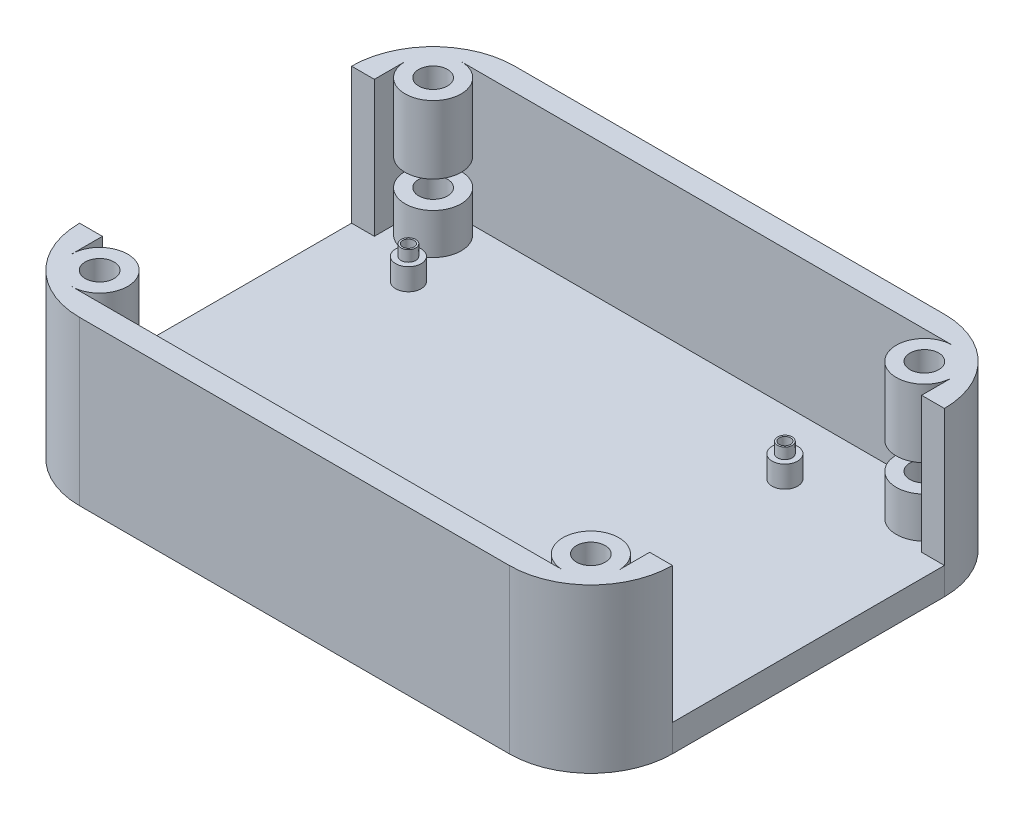
from build123d import *
from build123d.topology import SkipClean

# Parameters (mm, degrees)
BOSS_EXTRUDE1_DEPTH     = 5
SKETCH4_R               = 3.1
CUT_EXTRUDE1_DEPTH      = 4
BOSS_EXTRUDE3_DEPTH     = 30
CUT_EXTRUDE2_DEPTH      = 120.920807202
CUT_EXTRUDE2_DEPTH_BACK = 120.920807202
BOSS_EXTRUDE2_START     = 5
SKETCH3_R               = 1.35
SKETCH3_R_2             = 1.05
BOSS_EXTRUDE2_DEPTH     = 6
SKETCH13_R              = 2.35
SKETCH13_R_2            = 1.35
BOSS_EXTRUDE8_DEPTH     = 4
BOSS_EXTRUDE9_START     = -25
SKETCH14_R              = 5.15
SKETCH14_R_2            = 2.65
BOSS_EXTRUDE9_DEPTH     = 25
CUT_EXTRUDE4_START      = -25
SKETCH14_3_R            = 2.65
CUT_EXTRUDE4_DEPTH      = 25
CUT_EXTRUDE5_START      = -30
SKETCH14_4_R            = 2.65
CUT_EXTRUDE5_DEPTH      = 30
CUT_EXTRUDE6_DEPTH      = 2.5
CUT_EXTRUDE6_DEPTH_BACK = 2.5
CUT_EXTRUDE6_START      = -15
SKETCH14_6_R            = 5.15
SKETCH14_6_R_2          = 2.65


with BuildPart() as part:
    # Sketch1 → Boss-Extrude1 (new body)
    with BuildSketch(Plane(origin=(0, 0, 0), x_dir=(1, 0, 0), z_dir=(0, 1, 0))):
        with BuildLine():
            Line((-39.5, 40), (39.5, 40))
            ThreePointArc((39.5, 40), (50.106601718, 35.606601718), (54.5, 25))
            Line((54.5, 25), (54.5, -25))
            ThreePointArc((54.5, -25), (50.106601718, -35.606601718), (39.5, -40))
            Line((39.5, -40), (-39.5, -40))
            ThreePointArc((-39.5, -40), (-50.106601718, -35.606601718), (-54.5, -25))
            Line((-54.5, -25), (-54.5, 25))
            ThreePointArc((-54.5, 25), (-50.106601718, 35.606601718), (-39.5, 40))
        make_face()
    extrude(amount=BOSS_EXTRUDE1_DEPTH)

    # Sketch4 → Cut-Extrude1 (cut)
    with BuildSketch(Plane(origin=(0, 0, 0), x_dir=(1, 0, 0), z_dir=(0, 1, 0))):
        with Locations(Location((-37.5, -26.648136546, 0), (0, 0, 270))):
            Circle(SKETCH4_R)
        with Locations(Location((37.5, -26.648136546, 0), (0, 0, 270))):
            Circle(SKETCH4_R)
        with Locations(Location((37.5, 26.648136546, 0), (0, 0, 270))):
            Circle(SKETCH4_R)
        with Locations(Location((-37.5, 26.648136546, 0), (0, 0, 270))):
            Circle(SKETCH4_R)
        with Locations(Location((-17.5, 0, 0), (0, 0, 270))):
            Circle(SKETCH4_R)
        with Locations(Location((0, -17.5, 0), (0, 0, 270))):
            Circle(SKETCH4_R)
        with Locations(Location((17.5, 0, 0), (0, 0, 270))):
            Circle(SKETCH4_R)
        with Locations(Location((0, 17.5, 0), (0, 0, 270))):
            Circle(SKETCH4_R)
        with Locations(Location((-17.5, 17.5, 0), (0, 0, 270))):
            Circle(SKETCH4_R)
        with Locations(Location((17.5, 17.5, 0), (0, 0, 270))):
            Circle(SKETCH4_R)
        with Locations(Location((17.5, -17.5, 0), (0, 0, 270))):
            Circle(SKETCH4_R)
        with Locations(Location((-17.5, -17.5, 0), (0, 0, 270))):
            Circle(SKETCH4_R)
        with Locations(Location((0, 0, 0), (0, 0, 270))):
            Circle(SKETCH4_R)
    extrude(amount=CUT_EXTRUDE1_DEPTH, mode=Mode.SUBTRACT)

    # Sketch1<3> → Boss-Extrude3 (add)
    with BuildSketch(Plane(origin=(0, 0, 0), x_dir=(1, 0, 0), z_dir=(0, 1, 0))):
        with BuildLine():
            Line((-39.5, 40), (39.5, 40))
            ThreePointArc((39.5, 40), (50.106601718, 35.606601718), (54.5, 25))
            Line((54.5, 25), (54.5, -25))
            ThreePointArc((54.5, -25), (50.106601718, -35.606601718), (39.5, -40))
            Line((39.5, -40), (-39.5, -40))
            ThreePointArc((-39.5, -40), (-50.106601718, -35.606601718), (-54.5, -25))
            Line((-54.5, -25), (-54.5, 25))
            ThreePointArc((-54.5, 25), (-50.106601718, 35.606601718), (-39.5, 40))
        make_face()
        with BuildLine():
            ThreePointArc((-39.5, 33), (-45.156854249, 30.656854249), (-47.5, 25))
            Line((-47.5, 25), (-47.5, -25))
            ThreePointArc((-47.5, -25), (-45.156854249, -30.656854249), (-39.5, -33))
            Line((-39.5, -33), (39.5, -33))
            ThreePointArc((39.5, -33), (45.156854249, -30.656854249), (47.5, -25))
            Line((47.5, -25), (47.5, 25))
            ThreePointArc((47.5, 25), (45.156854249, 30.656854249), (39.5, 33))
            Line((39.5, 33), (-39.5, 33))
        make_face(mode=Mode.SUBTRACT)
    extrude(amount=BOSS_EXTRUDE3_DEPTH)

    # Sketch7 → Cut-Extrude2 (cut, two sides: drawn at the far end of the back side and taken through both)
    with BuildSketch(Plane.ZY.offset(54.5).offset(-CUT_EXTRUDE2_DEPTH_BACK)):
        Polygon((-20, 30), (-25, 30), (-25, 5), (-20, 5), (20, 5), (25, 5), (25, 30), (20, 30), align=None)
    extrude(amount=CUT_EXTRUDE2_DEPTH + CUT_EXTRUDE2_DEPTH_BACK, mode=Mode.SUBTRACT)

    # Sketch3 → Boss-Extrude2 (add)
    # profile 1 of 4: a face of its own
    with BuildSketch(Plane(origin=(0, 0, 0), x_dir=(1, 0, 0), z_dir=(0, 1, 0)).offset(BOSS_EXTRUDE2_START)):
        with Locations(Location((-40, 20.955, 0), (0, 0, 270))):
            Circle(SKETCH3_R)
        with Locations(Location((-40, 20.955, 0), (0, 0, 270))):
            Circle(SKETCH3_R_2, mode=Mode.SUBTRACT)
    # profile 2 of 4: a face of its own
    with BuildSketch(Plane(origin=(0, 0, 0), x_dir=(1, 0, 0), z_dir=(0, 1, 0)).offset(BOSS_EXTRUDE2_START)):
        with Locations(Location((-40, -20.955, 0), (0, 0, 270))):
            Circle(SKETCH3_R)
        with Locations(Location((-40, -20.955, 0), (0, 0, 270))):
            Circle(SKETCH3_R_2, mode=Mode.SUBTRACT)
    # profile 3 of 4: a face of its own
    with BuildSketch(Plane(origin=(0, 0, 0), x_dir=(1, 0, 0), z_dir=(0, 1, 0)).offset(BOSS_EXTRUDE2_START)):
        with Locations(Location((26.04, 24.13, 0), (0, 0, 270))):
            Circle(SKETCH3_R)
        with Locations(Location((26.04, 24.13, 0), (0, 0, 270))):
            Circle(SKETCH3_R_2, mode=Mode.SUBTRACT)
    # profile 4 of 4: a face of its own
    with BuildSketch(Plane(origin=(0, 0, 0), x_dir=(1, 0, 0), z_dir=(0, 1, 0)).offset(BOSS_EXTRUDE2_START)):
        with Locations(Location((26.04, -24.13, 0), (0, 0, 270))):
            Circle(SKETCH3_R)
        with Locations(Location((26.04, -24.13, 0), (0, 0, 270))):
            Circle(SKETCH3_R_2, mode=Mode.SUBTRACT)
    extrude(amount=BOSS_EXTRUDE2_DEPTH)

    # Sketch13 → Boss-Extrude8 (add)
    # profile 1 of 4: a face of its own
    with BuildSketch(Plane(origin=(0, 5, 0), x_dir=(1, 0, 0), z_dir=(0, 1, 0))):
        with Locations(Location((26.04, 24.13, 0), (0, 0, 270))):
            Circle(SKETCH13_R)
        with Locations(Location((26.04, 24.13, 0), (0, 0, 270))):
            Circle(SKETCH13_R_2, mode=Mode.SUBTRACT)
    # profile 2 of 4: a face of its own
    with BuildSketch(Plane(origin=(0, 5, 0), x_dir=(1, 0, 0), z_dir=(0, 1, 0))):
        with Locations(Location((26.04, -24.13, 0), (0, 0, 270))):
            Circle(SKETCH13_R)
        with Locations(Location((26.04, -24.13, 0), (0, 0, 270))):
            Circle(SKETCH13_R_2, mode=Mode.SUBTRACT)
    # profile 3 of 4: a face of its own
    with BuildSketch(Plane(origin=(0, 5, 0), x_dir=(1, 0, 0), z_dir=(0, 1, 0))):
        with Locations(Location((-40, -20.955, 0), (0, 0, 270))):
            Circle(SKETCH13_R)
        with Locations(Location((-40, -20.955, 0), (0, 0, 270))):
            Circle(SKETCH13_R_2, mode=Mode.SUBTRACT)
    # profile 4 of 4: a face of its own
    with BuildSketch(Plane(origin=(0, 5, 0), x_dir=(1, 0, 0), z_dir=(0, 1, 0))):
        with Locations(Location((-40, 20.955, 0), (0, 0, 270))):
            Circle(SKETCH13_R)
        with Locations(Location((-40, 20.955, 0), (0, 0, 270))):
            Circle(SKETCH13_R_2, mode=Mode.SUBTRACT)
    extrude(amount=BOSS_EXTRUDE8_DEPTH)

    # Sketch14 → Boss-Extrude9 (add)
    # profile 1 of 10: a face of its own
    with BuildSketch(Plane(origin=(0, 30, 0), x_dir=(1, 0, 0), z_dir=(0, 1, 0)).offset(BOSS_EXTRUDE9_START)):
        with Locations((-45.156854249, 30.656854249)):
            Circle(SKETCH14_R)
        with Locations((-45.156854249, 30.656854249)):
            Circle(SKETCH14_R_2, mode=Mode.SUBTRACT)
    # profile 2 of 10: a face of its own
    with BuildSketch(Plane(origin=(0, 30, 0), x_dir=(1, 0, 0), z_dir=(0, 1, 0)).offset(BOSS_EXTRUDE9_START)):
        with BuildLine():
            ThreePointArc((-40.006854249, -30.656854249), (-41.515254326, -27.015254326), (-45.156854249, -25.506854249))
            ThreePointArc((-45.156854249, -25.506854249), (-46.325143467, -25.641118979), (-47.432516165, -26.036912383))
            ThreePointArc((-47.432516165, -26.036912383), (-47.162977015, -27.297560286), (-46.694453762, -28.498547566))
            ThreePointArc((-46.694453762, -28.498547566), (-43.942798795, -28.301314109), (-42.506854249, -30.656854249))
            ThreePointArc((-42.506854249, -30.656854249), (-42.632768998, -31.464005812), (-42.998547566, -32.194453762))
            ThreePointArc((-42.998547566, -32.194453762), (-41.797560286, -32.662977015), (-40.536912383, -32.932516165))
            ThreePointArc((-40.536912383, -32.932516165), (-40.141118979, -31.825143467), (-40.006854249, -30.656854249))
        make_face()
    # profile 3 of 10: a face of its own
    with BuildSketch(Plane(origin=(0, 30, 0), x_dir=(1, 0, 0), z_dir=(0, 1, 0)).offset(BOSS_EXTRUDE9_START)):
        with BuildLine():
            ThreePointArc((-47.432516165, -26.036912383), (-49.5296199, -27.936299055), (-50.306854249, -30.656854249))
            ThreePointArc((-50.306854249, -30.656854249), (-48.798454173, -34.298454173), (-45.156854249, -35.806854249))
            ThreePointArc((-45.156854249, -35.806854249), (-42.436299055, -35.0296199), (-40.536912383, -32.932516165))
            ThreePointArc((-40.536912383, -32.932516165), (-41.797560286, -32.662977015), (-42.998547566, -32.194453762))
            ThreePointArc((-42.998547566, -32.194453762), (-47.03068722, -32.53068722), (-46.694453762, -28.498547566))
            ThreePointArc((-46.694453762, -28.498547566), (-47.162977015, -27.297560286), (-47.432516165, -26.036912383))
        make_face()
    # profile 4 of 10: a face of its own
    with BuildSketch(Plane(origin=(0, 30, 0), x_dir=(1, 0, 0), z_dir=(0, 1, 0)).offset(BOSS_EXTRUDE9_START)):
        with BuildLine():
            ThreePointArc((-40.006854249, -30.656854249), (-41.515254326, -27.015254326), (-45.156854249, -25.506854249))
            ThreePointArc((-45.156854249, -25.506854249), (-46.325143467, -25.641118979), (-47.432516165, -26.036912383))
            ThreePointArc((-47.432516165, -26.036912383), (-47.162977015, -27.297560286), (-46.694453762, -28.498547566))
            ThreePointArc((-46.694453762, -28.498547566), (-43.942798795, -28.301314109), (-42.506854249, -30.656854249))
            ThreePointArc((-42.506854249, -30.656854249), (-42.632768998, -31.464005812), (-42.998547566, -32.194453762))
            ThreePointArc((-42.998547566, -32.194453762), (-41.797560286, -32.662977015), (-40.536912383, -32.932516165))
            ThreePointArc((-40.536912383, -32.932516165), (-40.141118979, -31.825143467), (-40.006854249, -30.656854249))
        make_face()
    # profile 5 of 10: a face of its own
    with BuildSketch(Plane(origin=(0, 30, 0), x_dir=(1, 0, 0), z_dir=(0, 1, 0)).offset(BOSS_EXTRUDE9_START)):
        with BuildLine():
            ThreePointArc((-47.432516165, -26.036912383), (-49.5296199, -27.936299055), (-50.306854249, -30.656854249))
            ThreePointArc((-50.306854249, -30.656854249), (-48.798454173, -34.298454173), (-45.156854249, -35.806854249))
            ThreePointArc((-45.156854249, -35.806854249), (-42.436299055, -35.0296199), (-40.536912383, -32.932516165))
            ThreePointArc((-40.536912383, -32.932516165), (-41.797560286, -32.662977015), (-42.998547566, -32.194453762))
            ThreePointArc((-42.998547566, -32.194453762), (-47.03068722, -32.53068722), (-46.694453762, -28.498547566))
            ThreePointArc((-46.694453762, -28.498547566), (-47.162977015, -27.297560286), (-47.432516165, -26.036912383))
        make_face()
    # profile 6 of 10: a face of its own
    with BuildSketch(Plane(origin=(0, 30, 0), x_dir=(1, 0, 0), z_dir=(0, 1, 0)).offset(BOSS_EXTRUDE9_START)):
        with Locations((45.156854249, 30.656854249)):
            Circle(SKETCH14_R)
        with Locations((45.156854249, 30.656854249)):
            Circle(SKETCH14_R_2, mode=Mode.SUBTRACT)
    # profile 7 of 10: a face of its own
    with BuildSketch(Plane(origin=(0, 30, 0), x_dir=(1, 0, 0), z_dir=(0, 1, 0)).offset(BOSS_EXTRUDE9_START)):
        with BuildLine():
            ThreePointArc((47.432516165, -26.036912383), (46.325143467, -25.641118979), (45.156854249, -25.506854249))
            ThreePointArc((45.156854249, -25.506854249), (41.515254326, -27.015254326), (40.006854249, -30.656854249))
            ThreePointArc((40.006854249, -30.656854249), (40.141118979, -31.825143467), (40.536912383, -32.932516165))
            ThreePointArc((40.536912383, -32.932516165), (41.797560286, -32.662977015), (42.998547566, -32.194453762))
            ThreePointArc((42.998547566, -32.194453762), (43.283021279, -28.783021279), (46.694453762, -28.498547566))
            ThreePointArc((46.694453762, -28.498547566), (47.162977015, -27.297560286), (47.432516165, -26.036912383))
        make_face()
    # profile 8 of 10: a face of its own
    with BuildSketch(Plane(origin=(0, 30, 0), x_dir=(1, 0, 0), z_dir=(0, 1, 0)).offset(BOSS_EXTRUDE9_START)):
        with BuildLine():
            ThreePointArc((45.156854249, -35.806854249), (48.798454173, -34.298454173), (50.306854249, -30.656854249))
            ThreePointArc((50.306854249, -30.656854249), (49.5296199, -27.936299055), (47.432516165, -26.036912383))
            ThreePointArc((47.432516165, -26.036912383), (47.162977015, -27.297560286), (46.694453762, -28.498547566))
            ThreePointArc((46.694453762, -28.498547566), (47.51239439, -29.442798795), (47.806854249, -30.656854249))
            ThreePointArc((47.806854249, -30.656854249), (45.964005812, -33.180939501), (42.998547566, -32.194453762))
            ThreePointArc((42.998547566, -32.194453762), (41.797560286, -32.662977015), (40.536912383, -32.932516165))
            ThreePointArc((40.536912383, -32.932516165), (42.436299055, -35.0296199), (45.156854249, -35.806854249))
        make_face()
    # profile 9 of 10: a face of its own
    with BuildSketch(Plane(origin=(0, 30, 0), x_dir=(1, 0, 0), z_dir=(0, 1, 0)).offset(BOSS_EXTRUDE9_START)):
        with BuildLine():
            ThreePointArc((47.432516165, -26.036912383), (46.325143467, -25.641118979), (45.156854249, -25.506854249))
            ThreePointArc((45.156854249, -25.506854249), (41.515254326, -27.015254326), (40.006854249, -30.656854249))
            ThreePointArc((40.006854249, -30.656854249), (40.141118979, -31.825143467), (40.536912383, -32.932516165))
            ThreePointArc((40.536912383, -32.932516165), (41.797560286, -32.662977015), (42.998547566, -32.194453762))
            ThreePointArc((42.998547566, -32.194453762), (43.283021279, -28.783021279), (46.694453762, -28.498547566))
            ThreePointArc((46.694453762, -28.498547566), (47.162977015, -27.297560286), (47.432516165, -26.036912383))
        make_face()
    # profile 10 of 10: a face of its own
    with BuildSketch(Plane(origin=(0, 30, 0), x_dir=(1, 0, 0), z_dir=(0, 1, 0)).offset(BOSS_EXTRUDE9_START)):
        with BuildLine():
            ThreePointArc((45.156854249, -35.806854249), (48.798454173, -34.298454173), (50.306854249, -30.656854249))
            ThreePointArc((50.306854249, -30.656854249), (49.5296199, -27.936299055), (47.432516165, -26.036912383))
            ThreePointArc((47.432516165, -26.036912383), (47.162977015, -27.297560286), (46.694453762, -28.498547566))
            ThreePointArc((46.694453762, -28.498547566), (47.51239439, -29.442798795), (47.806854249, -30.656854249))
            ThreePointArc((47.806854249, -30.656854249), (45.964005812, -33.180939501), (42.998547566, -32.194453762))
            ThreePointArc((42.998547566, -32.194453762), (41.797560286, -32.662977015), (40.536912383, -32.932516165))
            ThreePointArc((40.536912383, -32.932516165), (42.436299055, -35.0296199), (45.156854249, -35.806854249))
        make_face()
    extrude(amount=BOSS_EXTRUDE9_DEPTH)

    # Sketch14<3> → Cut-Extrude4 (cut)
    with SkipClean():  # the faces are left unmerged after this step: merging them gives an invalid solid
        with BuildSketch(Plane(origin=(0, 30, 0), x_dir=(1, 0, 0), z_dir=(0, 1, 0)).offset(CUT_EXTRUDE4_START)):
            with Locations(Location((-45.156854249, 30.656854249, 0), (0, 0, 270))):
                Circle(SKETCH14_3_R)
            with BuildLine():
                ThreePointArc((-42.998547566, -32.194453762), (-45.156854249, -30.656854249), (-46.694453762, -28.498547566))
                ThreePointArc((-46.694453762, -28.498547566), (-47.03068722, -32.53068722), (-42.998547566, -32.194453762))
            make_face()
            with BuildLine():
                ThreePointArc((-42.506854249, -30.656854249), (-43.942798795, -28.301314109), (-46.694453762, -28.498547566))
                ThreePointArc((-46.694453762, -28.498547566), (-45.156854249, -30.656854249), (-42.998547566, -32.194453762))
                ThreePointArc((-42.998547566, -32.194453762), (-42.632768998, -31.464005812), (-42.506854249, -30.656854249))
            make_face()
            with Locations(Location((45.156854249, 30.656854249, 0), (0, 0, 270))):
                Circle(SKETCH14_3_R)
            with BuildLine():
                ThreePointArc((42.998547566, -32.194453762), (45.156854249, -30.656854249), (46.694453762, -28.498547566))
                ThreePointArc((46.694453762, -28.498547566), (43.283021279, -28.783021279), (42.998547566, -32.194453762))
            make_face()
            with BuildLine():
                ThreePointArc((47.806854249, -30.656854249), (47.51239439, -29.442798795), (46.694453762, -28.498547566))
                ThreePointArc((46.694453762, -28.498547566), (45.156854249, -30.656854249), (42.998547566, -32.194453762))
                ThreePointArc((42.998547566, -32.194453762), (45.964005812, -33.180939501), (47.806854249, -30.656854249))
            make_face()
            with BuildLine():
                ThreePointArc((-39.5, -33), (-40.019553019, -32.983111214), (-40.536912383, -32.932516165))
                ThreePointArc((-40.536912383, -32.932516165), (-42.436299055, -35.0296199), (-45.156854249, -35.806854249))
                Line((-45.156854249, -35.806854249), (45.156854249, -35.806854249))
                ThreePointArc((45.156854249, -35.806854249), (42.436299055, -35.0296199), (40.536912383, -32.932516165))
                ThreePointArc((40.536912383, -32.932516165), (40.019553019, -32.983111214), (39.5, -33))
                Line((39.5, -33), (-39.5, -33))
            make_face()
            with BuildLine():
                ThreePointArc((-45.156854249, 35.806854249), (-41.515254326, 34.298454173), (-40.006854249, 30.656854249))
                Line((-40.006854249, 30.656854249), (40.006854249, 30.656854249))
                ThreePointArc((40.006854249, 30.656854249), (41.515254326, 34.298454173), (45.156854249, 35.806854249))
                Line((45.156854249, 35.806854249), (-45.156854249, 35.806854249))
            make_face()
            with BuildLine():
                Line((40.006854249, -30.656854249), (-40.006854249, -30.656854249))
                ThreePointArc((-40.006854249, -30.656854249), (-40.141118979, -31.825143467), (-40.536912383, -32.932516165))
                ThreePointArc((-40.536912383, -32.932516165), (-40.019553019, -32.983111214), (-39.5, -33))
                Line((-39.5, -33), (39.5, -33))
                ThreePointArc((39.5, -33), (40.019553019, -32.983111214), (40.536912383, -32.932516165))
                ThreePointArc((40.536912383, -32.932516165), (40.141118979, -31.825143467), (40.006854249, -30.656854249))
            make_face()
            with BuildLine():
                Line((-45.156854249, -25.506854249), (-45.156854249, 25.506854249))
                ThreePointArc((-45.156854249, 25.506854249), (-48.798454173, 27.015254326), (-50.306854249, 30.656854249))
                Line((-50.306854249, 30.656854249), (-50.306854249, -25))
                Line((-50.306854249, -25), (-47.5, -25))
                ThreePointArc((-47.5, -25), (-47.483111214, -25.519553019), (-47.432516165, -26.036912383))
                ThreePointArc((-47.432516165, -26.036912383), (-46.325143467, -25.641118979), (-45.156854249, -25.506854249))
            make_face()
            with BuildLine():
                ThreePointArc((50.306854249, 30.656854249), (48.798454173, 27.015254326), (45.156854249, 25.506854249))
                Line((45.156854249, 25.506854249), (45.156854249, -25.506854249))
                ThreePointArc((45.156854249, -25.506854249), (46.325143467, -25.641118979), (47.432516165, -26.036912383))
                ThreePointArc((47.432516165, -26.036912383), (47.483111214, -25.519553019), (47.5, -25))
                Line((47.5, -25), (50.306854249, -25))
                Line((50.306854249, -25), (50.306854249, 30.656854249))
            make_face()
            with BuildLine():
                Line((50.306854249, -30.656854249), (50.306854249, -25))
                Line((50.306854249, -25), (47.5, -25))
                ThreePointArc((47.5, -25), (47.483111214, -25.519553019), (47.432516165, -26.036912383))
                ThreePointArc((47.432516165, -26.036912383), (49.5296199, -27.936299055), (50.306854249, -30.656854249))
            make_face()
            with BuildLine():
                Line((-47.5, -25), (-50.306854249, -25))
                Line((-50.306854249, -25), (-50.306854249, -30.656854249))
                ThreePointArc((-50.306854249, -30.656854249), (-49.5296199, -27.936299055), (-47.432516165, -26.036912383))
                ThreePointArc((-47.432516165, -26.036912383), (-47.483111214, -25.519553019), (-47.5, -25))
            make_face()
        extrude(amount=CUT_EXTRUDE4_DEPTH, mode=Mode.SUBTRACT)

    # Sketch14<4> → Cut-Extrude5 (cut)
    with SkipClean():  # the faces are left unmerged after this step: merging them gives an invalid solid
        with BuildSketch(Plane(origin=(0, 30, 0), x_dir=(1, 0, 0), z_dir=(0, 1, 0)).offset(CUT_EXTRUDE5_START)):
            with Locations(Location((-45.156854249, 30.656854249, 0), (0, 0, 270))):
                Circle(SKETCH14_4_R)
            with Locations(Location((45.156854249, 30.656854249, 0), (0, 0, 270))):
                Circle(SKETCH14_4_R)
            with BuildLine():
                ThreePointArc((42.998547566, -32.194453762), (45.156854249, -30.656854249), (46.694453762, -28.498547566))
                ThreePointArc((46.694453762, -28.498547566), (43.283021279, -28.783021279), (42.998547566, -32.194453762))
            make_face()
            with BuildLine():
                ThreePointArc((47.806854249, -30.656854249), (47.51239439, -29.442798795), (46.694453762, -28.498547566))
                ThreePointArc((46.694453762, -28.498547566), (45.156854249, -30.656854249), (42.998547566, -32.194453762))
                ThreePointArc((42.998547566, -32.194453762), (45.964005812, -33.180939501), (47.806854249, -30.656854249))
            make_face()
            with BuildLine():
                ThreePointArc((-42.998547566, -32.194453762), (-45.156854249, -30.656854249), (-46.694453762, -28.498547566))
                ThreePointArc((-46.694453762, -28.498547566), (-47.03068722, -32.53068722), (-42.998547566, -32.194453762))
            make_face()
            with BuildLine():
                ThreePointArc((-42.506854249, -30.656854249), (-43.942798795, -28.301314109), (-46.694453762, -28.498547566))
                ThreePointArc((-46.694453762, -28.498547566), (-45.156854249, -30.656854249), (-42.998547566, -32.194453762))
                ThreePointArc((-42.998547566, -32.194453762), (-42.632768998, -31.464005812), (-42.506854249, -30.656854249))
            make_face()
        extrude(amount=CUT_EXTRUDE5_DEPTH, mode=Mode.SUBTRACT)

    # Sketch14<6> → Cut-Extrude6 (cut, two sides: drawn at the far end of the back side and taken through both)
    # profile 1 of 10: a face of its own
    with SkipClean():  # the faces are left unmerged after this step: merging them gives an invalid solid
        with BuildSketch(Plane(origin=(0, 30, 0), x_dir=(1, 0, 0), z_dir=(0, 1, 0)).offset(CUT_EXTRUDE6_START - CUT_EXTRUDE6_DEPTH_BACK)):
            with BuildLine():
                ThreePointArc((47.432516165, -26.036912383), (46.325143467, -25.641118979), (45.156854249, -25.506854249))
                ThreePointArc((45.156854249, -25.506854249), (41.515254326, -27.015254326), (40.006854249, -30.656854249))
                ThreePointArc((40.006854249, -30.656854249), (40.141118979, -31.825143467), (40.536912383, -32.932516165))
                ThreePointArc((40.536912383, -32.932516165), (41.797560286, -32.662977015), (42.998547566, -32.194453762))
                ThreePointArc((42.998547566, -32.194453762), (43.283021279, -28.783021279), (46.694453762, -28.498547566))
                ThreePointArc((46.694453762, -28.498547566), (47.162977015, -27.297560286), (47.432516165, -26.036912383))
            make_face()
        # profile 2 of 10: a face of its own
        with BuildSketch(Plane(origin=(0, 30, 0), x_dir=(1, 0, 0), z_dir=(0, 1, 0)).offset(CUT_EXTRUDE6_START - CUT_EXTRUDE6_DEPTH_BACK)):
            with BuildLine():
                ThreePointArc((45.156854249, -35.806854249), (48.798454173, -34.298454173), (50.306854249, -30.656854249))
                ThreePointArc((50.306854249, -30.656854249), (49.5296199, -27.936299055), (47.432516165, -26.036912383))
                ThreePointArc((47.432516165, -26.036912383), (47.162977015, -27.297560286), (46.694453762, -28.498547566))
                ThreePointArc((46.694453762, -28.498547566), (47.51239439, -29.442798795), (47.806854249, -30.656854249))
                ThreePointArc((47.806854249, -30.656854249), (45.964005812, -33.180939501), (42.998547566, -32.194453762))
                ThreePointArc((42.998547566, -32.194453762), (41.797560286, -32.662977015), (40.536912383, -32.932516165))
                ThreePointArc((40.536912383, -32.932516165), (42.436299055, -35.0296199), (45.156854249, -35.806854249))
            make_face()
        # profile 3 of 10: a face of its own
        with BuildSketch(Plane(origin=(0, 30, 0), x_dir=(1, 0, 0), z_dir=(0, 1, 0)).offset(CUT_EXTRUDE6_START - CUT_EXTRUDE6_DEPTH_BACK)):
            with BuildLine():
                ThreePointArc((47.432516165, -26.036912383), (46.325143467, -25.641118979), (45.156854249, -25.506854249))
                ThreePointArc((45.156854249, -25.506854249), (41.515254326, -27.015254326), (40.006854249, -30.656854249))
                ThreePointArc((40.006854249, -30.656854249), (40.141118979, -31.825143467), (40.536912383, -32.932516165))
                ThreePointArc((40.536912383, -32.932516165), (41.797560286, -32.662977015), (42.998547566, -32.194453762))
                ThreePointArc((42.998547566, -32.194453762), (43.283021279, -28.783021279), (46.694453762, -28.498547566))
                ThreePointArc((46.694453762, -28.498547566), (47.162977015, -27.297560286), (47.432516165, -26.036912383))
            make_face()
        # profile 4 of 10: a face of its own
        with BuildSketch(Plane(origin=(0, 30, 0), x_dir=(1, 0, 0), z_dir=(0, 1, 0)).offset(CUT_EXTRUDE6_START - CUT_EXTRUDE6_DEPTH_BACK)):
            with BuildLine():
                ThreePointArc((45.156854249, -35.806854249), (48.798454173, -34.298454173), (50.306854249, -30.656854249))
                ThreePointArc((50.306854249, -30.656854249), (49.5296199, -27.936299055), (47.432516165, -26.036912383))
                ThreePointArc((47.432516165, -26.036912383), (47.162977015, -27.297560286), (46.694453762, -28.498547566))
                ThreePointArc((46.694453762, -28.498547566), (47.51239439, -29.442798795), (47.806854249, -30.656854249))
                ThreePointArc((47.806854249, -30.656854249), (45.964005812, -33.180939501), (42.998547566, -32.194453762))
                ThreePointArc((42.998547566, -32.194453762), (41.797560286, -32.662977015), (40.536912383, -32.932516165))
                ThreePointArc((40.536912383, -32.932516165), (42.436299055, -35.0296199), (45.156854249, -35.806854249))
            make_face()
        # profile 5 of 10: a face of its own
        with BuildSketch(Plane(origin=(0, 30, 0), x_dir=(1, 0, 0), z_dir=(0, 1, 0)).offset(CUT_EXTRUDE6_START - CUT_EXTRUDE6_DEPTH_BACK)):
            with Locations((45.156854249, 30.656854249)):
                Circle(SKETCH14_6_R)
            with Locations(Location((45.156854249, 30.656854249, 0), (0, 0, 270))):
                Circle(SKETCH14_6_R_2, mode=Mode.SUBTRACT)
        # profile 6 of 10: a face of its own
        with BuildSketch(Plane(origin=(0, 30, 0), x_dir=(1, 0, 0), z_dir=(0, 1, 0)).offset(CUT_EXTRUDE6_START - CUT_EXTRUDE6_DEPTH_BACK)):
            with Locations((-45.156854249, 30.656854249)):
                Circle(SKETCH14_6_R)
            with Locations(Location((-45.156854249, 30.656854249, 0), (0, 0, 270))):
                Circle(SKETCH14_6_R_2, mode=Mode.SUBTRACT)
        # profile 7 of 10: a face of its own
        with BuildSketch(Plane(origin=(0, 30, 0), x_dir=(1, 0, 0), z_dir=(0, 1, 0)).offset(CUT_EXTRUDE6_START - CUT_EXTRUDE6_DEPTH_BACK)):
            with BuildLine():
                ThreePointArc((-40.006854249, -30.656854249), (-41.515254326, -27.015254326), (-45.156854249, -25.506854249))
                ThreePointArc((-45.156854249, -25.506854249), (-46.325143467, -25.641118979), (-47.432516165, -26.036912383))
                ThreePointArc((-47.432516165, -26.036912383), (-47.162977015, -27.297560286), (-46.694453762, -28.498547566))
                ThreePointArc((-46.694453762, -28.498547566), (-43.942798795, -28.301314109), (-42.506854249, -30.656854249))
                ThreePointArc((-42.506854249, -30.656854249), (-42.632768998, -31.464005812), (-42.998547566, -32.194453762))
                ThreePointArc((-42.998547566, -32.194453762), (-41.797560286, -32.662977015), (-40.536912383, -32.932516165))
                ThreePointArc((-40.536912383, -32.932516165), (-40.141118979, -31.825143467), (-40.006854249, -30.656854249))
            make_face()
        # profile 8 of 10: a face of its own
        with BuildSketch(Plane(origin=(0, 30, 0), x_dir=(1, 0, 0), z_dir=(0, 1, 0)).offset(CUT_EXTRUDE6_START - CUT_EXTRUDE6_DEPTH_BACK)):
            with BuildLine():
                ThreePointArc((-47.432516165, -26.036912383), (-49.5296199, -27.936299055), (-50.306854249, -30.656854249))
                ThreePointArc((-50.306854249, -30.656854249), (-48.798454173, -34.298454173), (-45.156854249, -35.806854249))
                ThreePointArc((-45.156854249, -35.806854249), (-42.436299055, -35.0296199), (-40.536912383, -32.932516165))
                ThreePointArc((-40.536912383, -32.932516165), (-41.797560286, -32.662977015), (-42.998547566, -32.194453762))
                ThreePointArc((-42.998547566, -32.194453762), (-47.03068722, -32.53068722), (-46.694453762, -28.498547566))
                ThreePointArc((-46.694453762, -28.498547566), (-47.162977015, -27.297560286), (-47.432516165, -26.036912383))
            make_face()
        # profile 9 of 10: a face of its own
        with BuildSketch(Plane(origin=(0, 30, 0), x_dir=(1, 0, 0), z_dir=(0, 1, 0)).offset(CUT_EXTRUDE6_START - CUT_EXTRUDE6_DEPTH_BACK)):
            with BuildLine():
                ThreePointArc((-40.006854249, -30.656854249), (-41.515254326, -27.015254326), (-45.156854249, -25.506854249))
                ThreePointArc((-45.156854249, -25.506854249), (-46.325143467, -25.641118979), (-47.432516165, -26.036912383))
                ThreePointArc((-47.432516165, -26.036912383), (-47.162977015, -27.297560286), (-46.694453762, -28.498547566))
                ThreePointArc((-46.694453762, -28.498547566), (-43.942798795, -28.301314109), (-42.506854249, -30.656854249))
                ThreePointArc((-42.506854249, -30.656854249), (-42.632768998, -31.464005812), (-42.998547566, -32.194453762))
                ThreePointArc((-42.998547566, -32.194453762), (-41.797560286, -32.662977015), (-40.536912383, -32.932516165))
                ThreePointArc((-40.536912383, -32.932516165), (-40.141118979, -31.825143467), (-40.006854249, -30.656854249))
            make_face()
        # profile 10 of 10: a face of its own
        with BuildSketch(Plane(origin=(0, 30, 0), x_dir=(1, 0, 0), z_dir=(0, 1, 0)).offset(CUT_EXTRUDE6_START - CUT_EXTRUDE6_DEPTH_BACK)):
            with BuildLine():
                ThreePointArc((-47.432516165, -26.036912383), (-49.5296199, -27.936299055), (-50.306854249, -30.656854249))
                ThreePointArc((-50.306854249, -30.656854249), (-48.798454173, -34.298454173), (-45.156854249, -35.806854249))
                ThreePointArc((-45.156854249, -35.806854249), (-42.436299055, -35.0296199), (-40.536912383, -32.932516165))
                ThreePointArc((-40.536912383, -32.932516165), (-41.797560286, -32.662977015), (-42.998547566, -32.194453762))
                ThreePointArc((-42.998547566, -32.194453762), (-47.03068722, -32.53068722), (-46.694453762, -28.498547566))
                ThreePointArc((-46.694453762, -28.498547566), (-47.162977015, -27.297560286), (-47.432516165, -26.036912383))
            make_face()
        extrude(amount=CUT_EXTRUDE6_DEPTH + CUT_EXTRUDE6_DEPTH_BACK, mode=Mode.SUBTRACT)


solid = part.part
